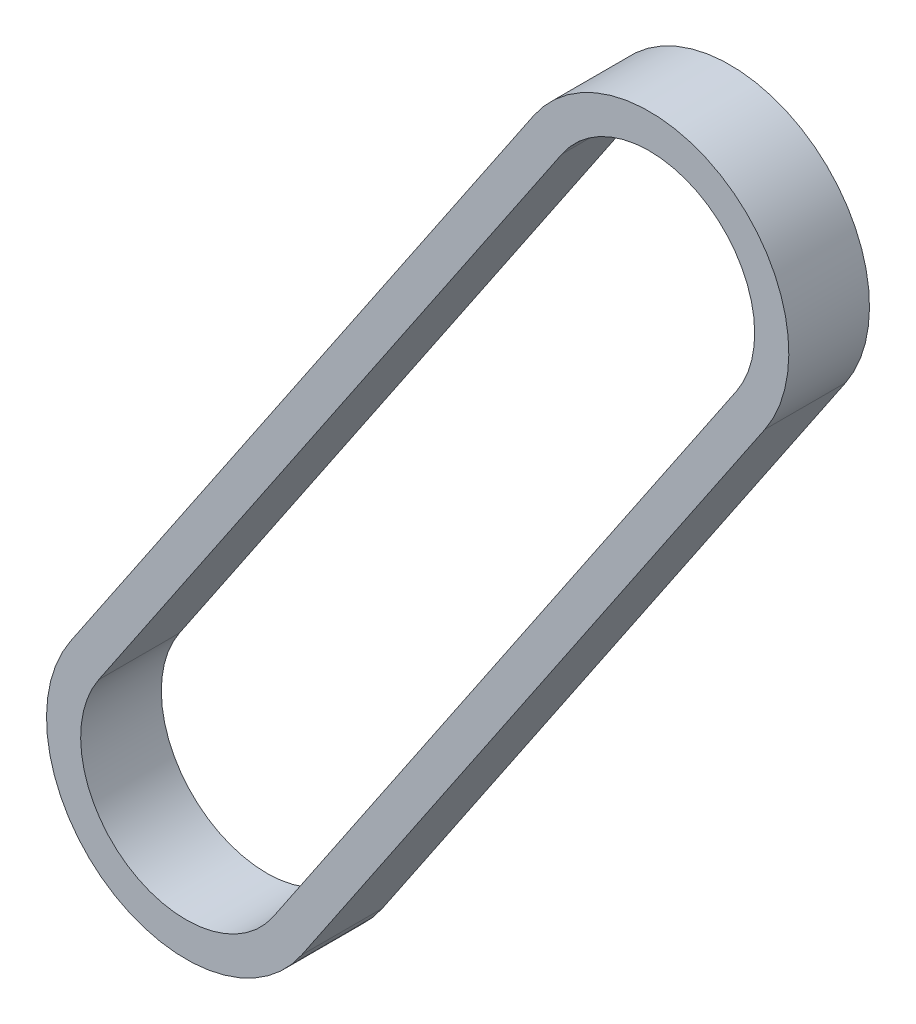
from build123d import *

# Parameters (mm, degrees)
EXTRUDE_THIN1_DEPTH = 9


with BuildPart() as part:
    # Sketch2 → Extrude-Thin1 (new body)
    with BuildSketch(Plane.XY):
        with BuildLine():
            Line((64.592223182, 67.930558641), (12.902389333, -8.702771493))
            ThreePointArc((12.902389333, -8.702771493), (-8.702771493, -12.902389333), (-12.902389333, 8.702771493))
            Line((-12.902389333, 8.702771493), (38.787444516, 85.336101627))
            ThreePointArc((38.787444516, 85.336101627), (60.392605342, 89.535719467), (64.592223182, 67.930558641))
        make_face()
        with BuildLine():
            Line((61.433590031, 70.061083603), (9.743756182, -6.572246531))
            ThreePointArc((9.743756182, -6.572246531), (-6.572246531, -9.743756182), (-9.743756182, 6.572246531))
            Line((-9.743756182, 6.572246531), (41.946077668, 83.205576664))
            ThreePointArc((41.946077668, 83.205576664), (58.26208038, 86.377086316), (61.433590031, 70.061083603))
        make_face(mode=Mode.SUBTRACT)
    extrude(amount=EXTRUDE_THIN1_DEPTH)


solid = part.part
